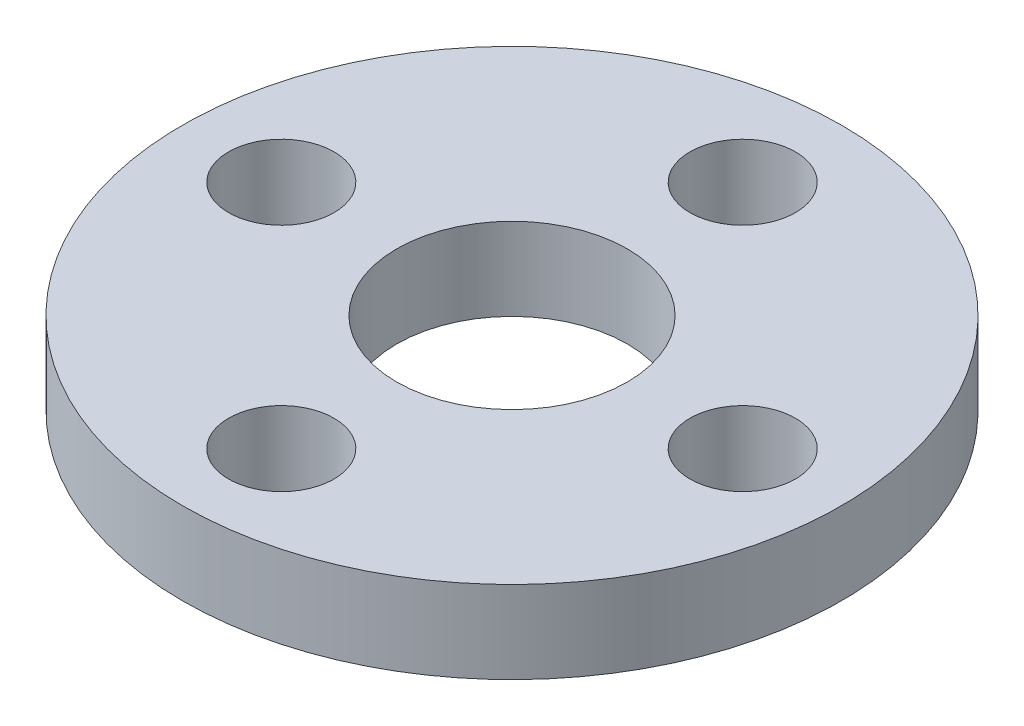
from build123d import *

# Parameters (mm, degrees)
SKETCH_1_R      = 10
SKETCH_1_R_2    = 1.6
SKETCH_1_R_3    = 3.5
EXTRUDE_1_DEPTH = 2.5


with BuildPart() as part:
    # 草图1 → 凸台-拉伸1 (new body)
    with BuildSketch(Plane(origin=(0, 0, 0), x_dir=(1, 0, 0), z_dir=(0, 1, 0))):
        with Locations(Location((0, 0, 0), (0, 0, 270))):
            Circle(SKETCH_1_R)
        with Locations(Location((0, 7, 0), (0, 0, 270))):
            Circle(SKETCH_1_R_2, mode=Mode.SUBTRACT)
        with Locations(Location((7, 0, 0), (0, 0, 270))):
            Circle(SKETCH_1_R_2, mode=Mode.SUBTRACT)
        with Locations(Location((0, 0, 0), (0, 0, 270))):
            Circle(SKETCH_1_R_3, mode=Mode.SUBTRACT)
        with Locations(Location((0, -7, 0), (0, 0, 90))):
            Circle(SKETCH_1_R_2, mode=Mode.SUBTRACT)
        with Locations(Location((-7, 0, 0), (0, 0, 90))):
            Circle(SKETCH_1_R_2, mode=Mode.SUBTRACT)
    extrude(amount=EXTRUDE_1_DEPTH)


solid = part.part
